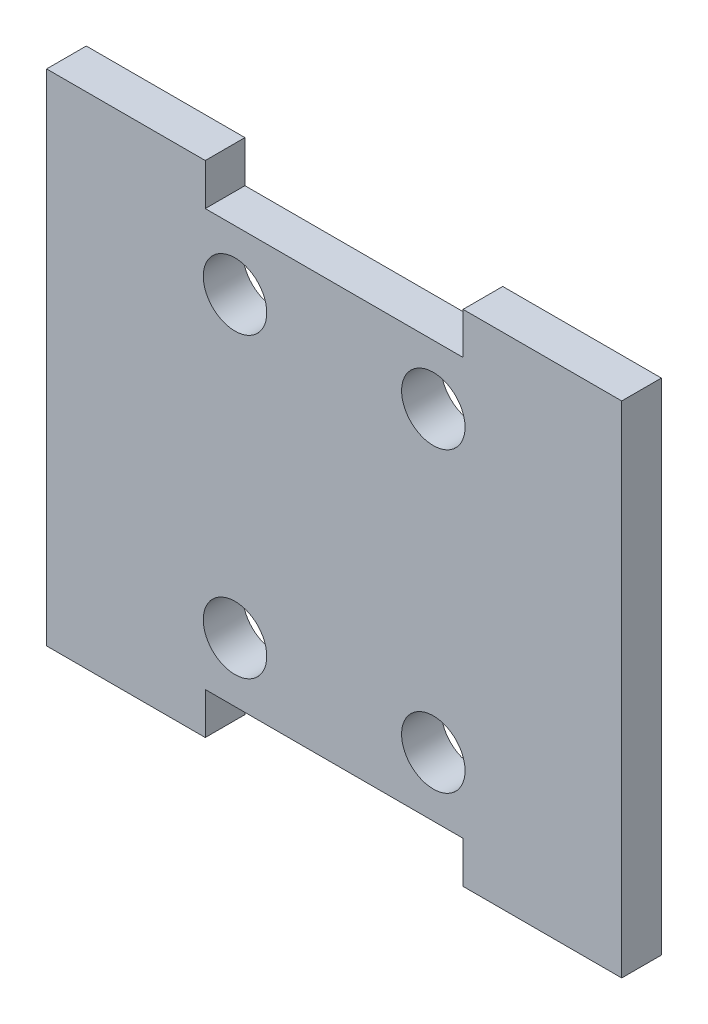
from build123d import *

# Parameters (mm, degrees)
SKETCH_1_W      = 29
SKETCH_1_H      = 21
SKETCH_1_R      = 1.6
SKETCH_1_W_2    = 8
SKETCH_1_H_2    = 2.1
EXTRUDE_1_DEPTH = 2


with BuildPart() as part:
    # 草图1 → 凸台-拉伸1 (new body)
    # profile 1 of 5: a face of its own
    with BuildSketch(Plane.XY):
        with Locations((-10.082297853, 0)):
            Rectangle(SKETCH_1_W, SKETCH_1_H)
        with Locations((-15.082297853, 7.5)):
            Circle(SKETCH_1_R, mode=Mode.SUBTRACT)
        with Locations((-5.082297853, 7.5)):
            Circle(SKETCH_1_R, mode=Mode.SUBTRACT)
        with Locations((-15.082297853, -7.5)):
            Circle(SKETCH_1_R, mode=Mode.SUBTRACT)
        with Locations((-5.082297853, -7.5)):
            Circle(SKETCH_1_R, mode=Mode.SUBTRACT)
    # profile 2 of 5: a face of its own
    with BuildSketch(Plane.XY):
        with Locations((-20.582297853, 11.55)):
            Rectangle(SKETCH_1_W_2, SKETCH_1_H_2)
    # profile 3 of 5: a face of its own
    with BuildSketch(Plane.XY):
        with Locations((0.417702147, 11.55)):
            Rectangle(SKETCH_1_W_2, SKETCH_1_H_2)
    # profile 4 of 5: a face of its own
    with BuildSketch(Plane.XY):
        with Locations((-20.582297853, -11.55)):
            Rectangle(SKETCH_1_W_2, SKETCH_1_H_2)
    # profile 5 of 5: a face of its own
    with BuildSketch(Plane.XY):
        with Locations((0.417702147, -11.55)):
            Rectangle(SKETCH_1_W_2, SKETCH_1_H_2)
    extrude(amount=EXTRUDE_1_DEPTH)


solid = part.part
